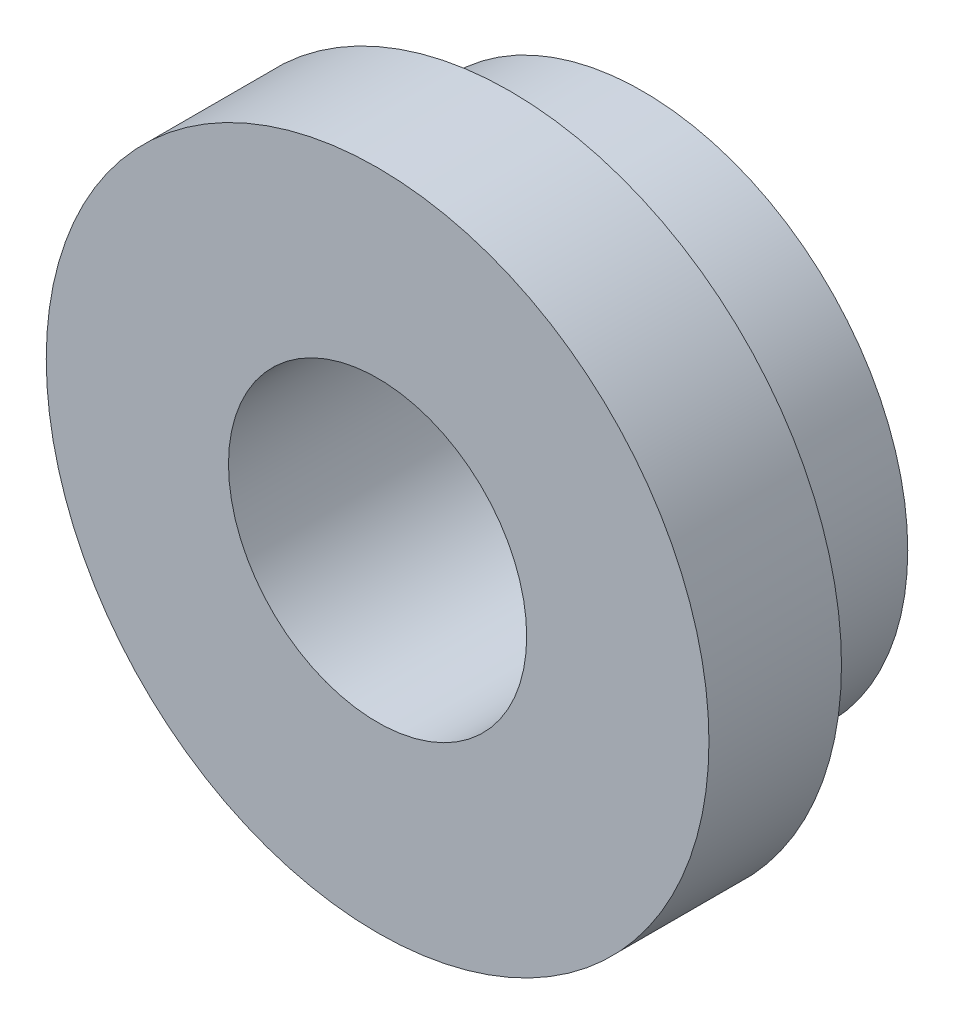
from build123d import *

# Parameters (mm, degrees)
SKETCH1_R           = 4
SKETCH1_R_2         = 2.25
BOSS_EXTRUDE1_DEPTH = 2
SKETCH2_R           = 5
SKETCH2_R_2         = 2.25
BOSS_EXTRUDE2_DEPTH = 2


with BuildPart() as part:
    # Sketch1 → Boss-Extrude1 (new body)
    with BuildSketch(Plane.XY):
        Circle(SKETCH1_R)
        Circle(SKETCH1_R_2, mode=Mode.SUBTRACT)
    extrude(amount=BOSS_EXTRUDE1_DEPTH)

    # Sketch2 → Boss-Extrude2 (add)
    with BuildSketch(Plane.XY.offset(2)):
        with Locations(Location((0, 0, 0), (0, 0, 180))):
            Circle(SKETCH2_R)
        with Locations(Location((0, 0, 0), (0, 0, 180))):
            Circle(SKETCH2_R_2, mode=Mode.SUBTRACT)
    extrude(amount=BOSS_EXTRUDE2_DEPTH)


solid = part.part
